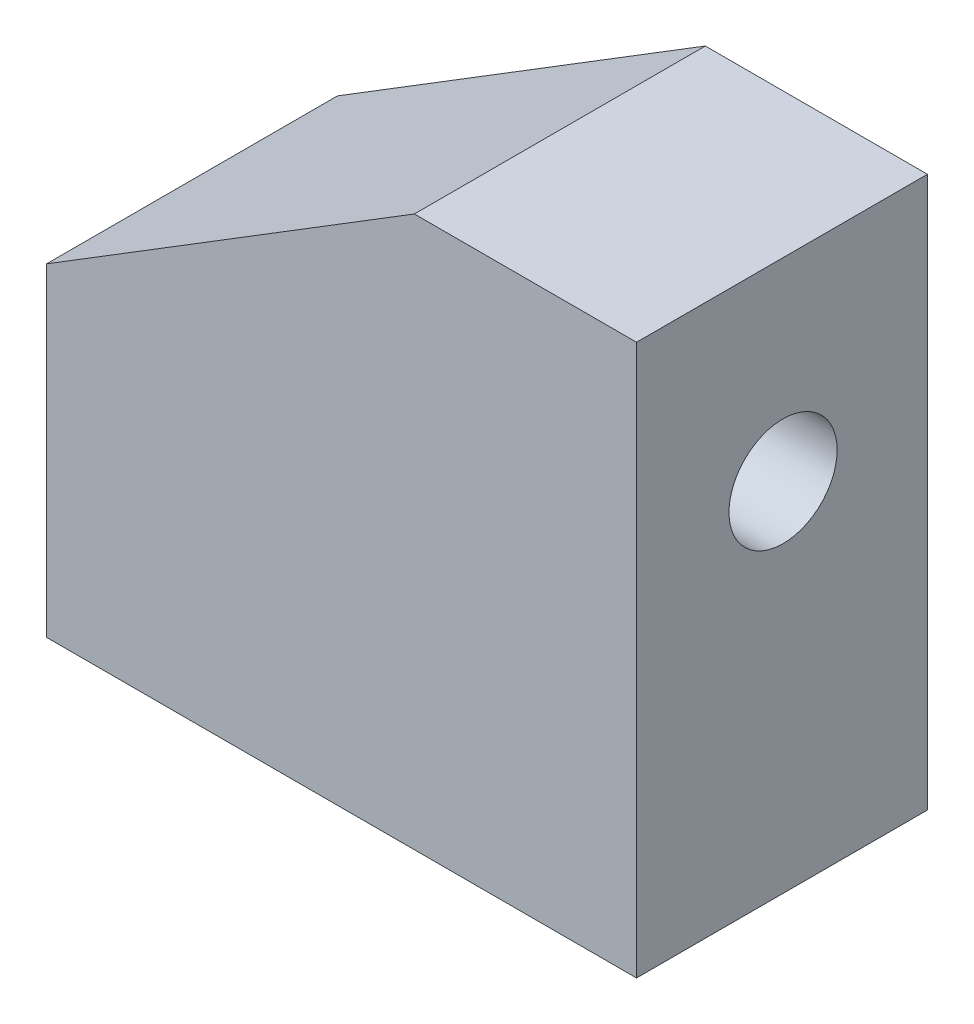
from build123d import *

# Parameters (mm, degrees)
BOSS_EXTRUDE1_DEPTH = 43
SKETCH3_R           = 7.992270034
CUT_EXTRUDE1_DEPTH  = 20


with BuildPart() as part:
    # Sketch2 → Boss-Extrude1 (new body)
    with BuildSketch(Plane.XY):
        Polygon((0, 0), (87.19917995, 0), (87.19917995, 81.375648563), (54.363553776, 81.375648563), (0, 47.810341807), align=None)
    extrude(amount=BOSS_EXTRUDE1_DEPTH)

    # Sketch3 → Cut-Extrude1 (cut)
    with BuildSketch(Plane(origin=(87.19917995, 0, 0), x_dir=(0, 0, -1), z_dir=(1, 0, 0))):
        with Locations((-21.34258453, 52.75634367)):
            Circle(SKETCH3_R)
    extrude(amount=-CUT_EXTRUDE1_DEPTH, mode=Mode.SUBTRACT)


solid = part.part
